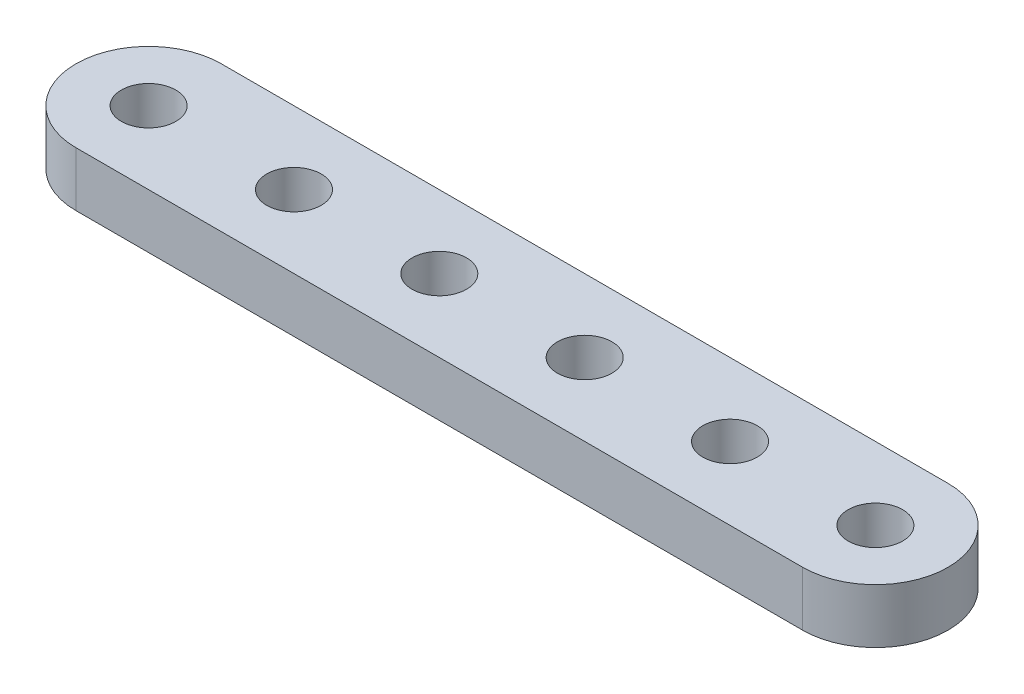
from build123d import *

# Parameters (mm, degrees)
SKETCH2_R           = 1.5
BOSS_EXTRUDE2_DEPTH = 3


with BuildPart() as part:
    # Sketch2 → Boss-Extrude2 (new body)
    with BuildSketch(Plane(origin=(0, 0, 0), x_dir=(1, 0, 0), z_dir=(0, 1, 0))):
        with BuildLine():
            Line((0, 4), (40, 4))
            ThreePointArc((40, 4), (44, 0), (40, -4))
            Line((40, -4), (0, -4))
            ThreePointArc((0, -4), (-4, 0), (0, 4))
        make_face()
        with Locations(Location((0, 0, 0), (0, 0, 270))):
            Circle(SKETCH2_R, mode=Mode.SUBTRACT)
        with Locations(Location((8, 0, 0), (0, 0, 270))):
            Circle(SKETCH2_R, mode=Mode.SUBTRACT)
        with Locations(Location((16, 0, 0), (0, 0, 270))):
            Circle(SKETCH2_R, mode=Mode.SUBTRACT)
        with Locations(Location((24, 0, 0), (0, 0, 270))):
            Circle(SKETCH2_R, mode=Mode.SUBTRACT)
        with Locations(Location((32, 0, 0), (0, 0, 270))):
            Circle(SKETCH2_R, mode=Mode.SUBTRACT)
        with Locations(Location((40, 0, 0), (0, 0, 270))):
            Circle(SKETCH2_R, mode=Mode.SUBTRACT)
    extrude(amount=BOSS_EXTRUDE2_DEPTH)


solid = part.part
